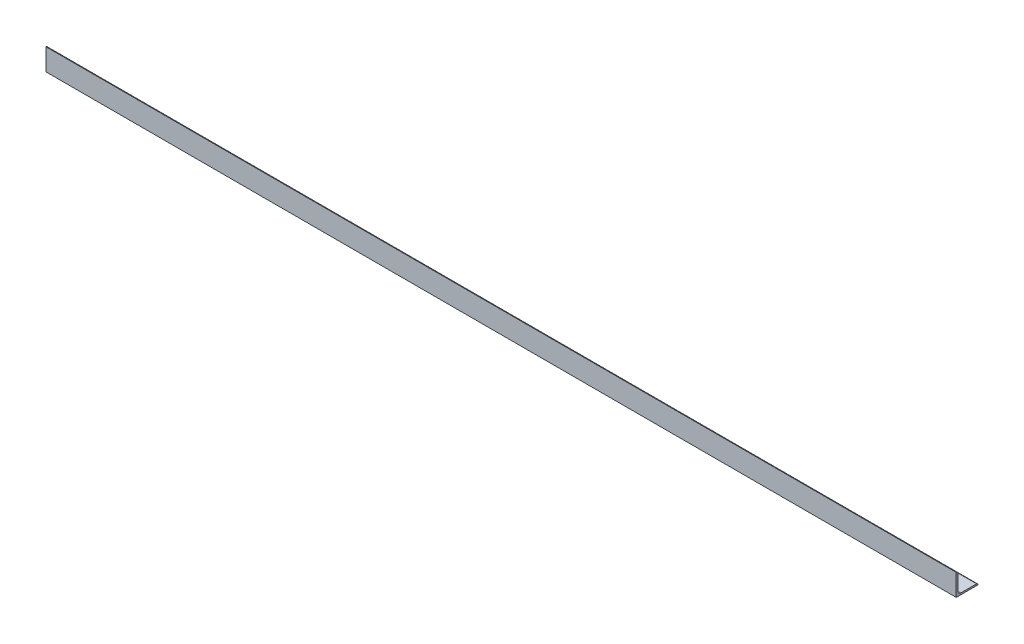
from build123d import *

# Parameters (mm, degrees)
L_ANGLE_EQUAL_40X40X3_8_DEPTH = 1674


with BuildPart() as part:
    # Sketch13 → L angle (equal) 40X40X3(8) (new body)
    with BuildSketch(Plane(origin=(0, 0, 0), x_dir=(0, 0, -1), z_dir=(1, 0, 0))):
        with BuildLine():
            Line((0, 40), (0, 0))
            Line((0, 0), (40, 0))
            ThreePointArc((40, 0), (39.121320344, 2.121320344), (37, 3))
            Line((37, 3), (9, 3))
            ThreePointArc((9, 3), (4.757359313, 4.757359313), (3, 9))
            Line((3, 9), (3, 37))
            ThreePointArc((3, 37), (2.121320344, 39.121320344), (0, 40))
        make_face()
    extrude(amount=L_ANGLE_EQUAL_40X40X3_8_DEPTH)


solid = part.part
